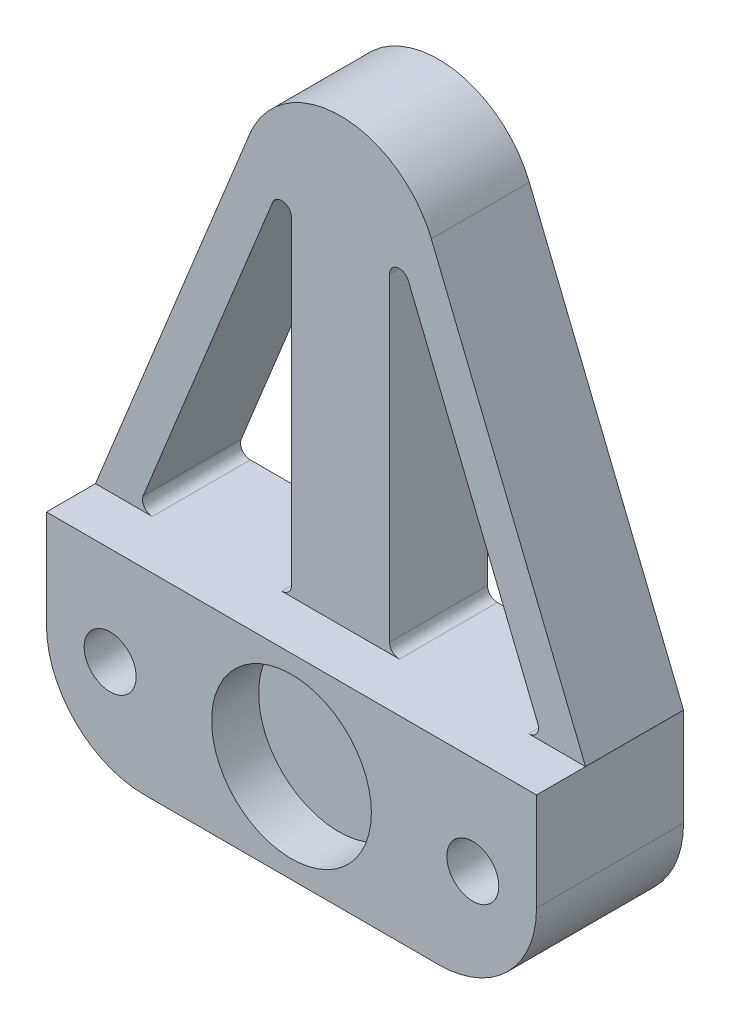
from build123d import *

# Parameters (mm, degrees)
SKETCH_1_W          = 50
SKETCH_1_H          = 20
SKETCH_1_R          = 2.65
EXTRUDE_1_DEPTH     = 15
SKETCH_2_R          = 5.175
CUT_EXTRUDE_1_DEPTH = 5.5
SKETCH_3_R          = 8.15
CUT_EXTRUDE_2_DEPTH = 4.8
EXTRUDE_2_DEPTH     = 10
SKETCH_5_R          = 8.2
CUT_EXTRUDE_3_DEPTH = 6
CUT_EXTRUDE_4_DEPTH = 63.24949799
FILLET_1_R          = 1
FILLET_3_R          = 10


with BuildPart() as part:
    # 草图1 → 凸台-拉伸1 (new body)
    with BuildSketch(Plane.XY):
        Rectangle(SKETCH_1_W, SKETCH_1_H)
        with Locations((-18.5, 0)):
            Circle(SKETCH_1_R, mode=Mode.SUBTRACT)
        with Locations((18.5, 0)):
            Circle(SKETCH_1_R, mode=Mode.SUBTRACT)
    extrude(amount=EXTRUDE_1_DEPTH)

    # 草图2 → 切除-拉伸1 (cut)
    with BuildSketch(Plane(origin=(0, 0, 0), x_dir=(-1, 0, 0), z_dir=(0, 0, -1))):
        Circle(SKETCH_2_R)
    extrude(amount=-CUT_EXTRUDE_1_DEPTH, mode=Mode.SUBTRACT)

    # 草图3 → 切除-拉伸2 (cut)
    with BuildSketch(Plane.XY.offset(15)):
        Circle(SKETCH_3_R)
    extrude(amount=-CUT_EXTRUDE_2_DEPTH, mode=Mode.SUBTRACT)

    # 草图4 → 凸台-拉伸2 (add)
    with BuildSketch(Plane(origin=(0, 0, 0), x_dir=(-1, 0, 0), z_dir=(0, 0, -1))):
        with BuildLine():
            Line((25, 10), (9.265702954, 48.761216396))
            ThreePointArc((9.265702954, 48.761216396), (0, 55), (-9.265702954, 48.761216396))
            Line((-9.265702954, 48.761216396), (-25, 10))
            Line((-25, 10), (25, 10))
        make_face()
    extrude(amount=-EXTRUDE_2_DEPTH)

    # 草图5 → 切除-拉伸3 (cut)
    with BuildSketch(Plane(origin=(0, 0, 0), x_dir=(-1, 0, 0), z_dir=(0, 0, -1))):
        with Locations((0, 45)):
            Circle(SKETCH_5_R)
    extrude(amount=-CUT_EXTRUDE_3_DEPTH, mode=Mode.SUBTRACT)

    # 草图6 → 切除-拉伸4 (cut, through all)
    with BuildSketch(Plane(origin=(0, 0, 0), x_dir=(-1, 0, 0), z_dir=(0, 0, -1))):
        Polygon((-20.683004279, 10), (-5, 48.634857396), (-5, 10), align=None)
        Polygon((5, 10), (20.683004279, 10), (5, 48.634857396), align=None)
    extrude(amount=-CUT_EXTRUDE_4_DEPTH, mode=Mode.SUBTRACT)

    # 圆角1
    fillet_1_edges = [part.edges().sort_by_distance(p)[0] for p in [
        (5, 10, 5),
        (20.683004279, 10, 5),
        (5, 48.634857396, 8),
        (-20.683004279, 10, 5),
        (-5, 10, 5),
        (-5, 48.634857396, 8),
    ]]
    fillet(fillet_1_edges, radius=FILLET_1_R)

    # 圆角3
    fillet_3_edges = [part.edges().sort_by_distance(p)[0] for p in [
        (25, -10, 7.5),
        (-25, -10, 7.5),
    ]]
    fillet(fillet_3_edges, radius=FILLET_3_R)


solid = part.part
